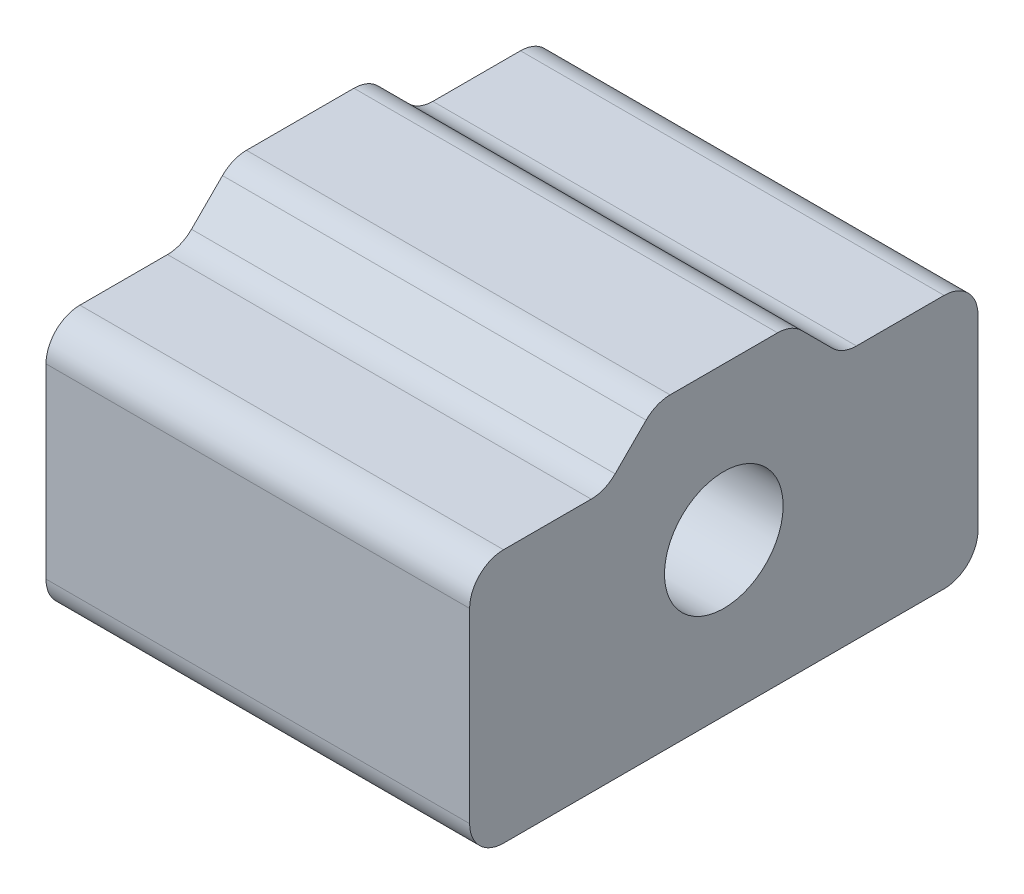
from build123d import *

# Parameters (mm, degrees)
SKETCH_1_W          = 25
SKETCH_1_H          = 30
EXTRUDE_2_DEPTH     = 18
CUT_EXTRUDE_1_DEPTH = 33
CUT_EXTRUDE_2_DEPTH = 33
SKETCH_6_R          = 3.5
CUT_EXTRUDE_3_DEPTH = 33
SKETCH_8_R          = 2
CUT_EXTRUDE_4_DEPTH = 6
FILLET_2_R          = 2


with BuildPart() as part:
    # 草图1 → 凸台-拉伸2 (new body)
    with BuildSketch(Plane(origin=(0, 0, 0), x_dir=(1, 0, 0), z_dir=(0, 1, 0))):
        with Locations((-18.558036971, -0.486406136)):
            Rectangle(SKETCH_1_W, SKETCH_1_H)
    extrude(amount=EXTRUDE_2_DEPTH)

    # 草图3 → 切除-拉伸1 (cut)
    with BuildSketch(Plane(origin=(-6.058036971, 0, 0), x_dir=(0, 0, -1), z_dir=(1, 0, 0))):
        Polygon((-15.486406136, 15), (-7.486406136, 15), (-4.486406136, 18), (-15.486406136, 18), align=None)
    extrude(amount=-CUT_EXTRUDE_1_DEPTH, mode=Mode.SUBTRACT)

    # 草图5 → 切除-拉伸2 (cut)
    with BuildSketch(Plane(origin=(-6.058036971, 0, 0), x_dir=(0, 0, -1), z_dir=(1, 0, 0))):
        Polygon((14.513593864, 18), (14.513593864, 15), (6.513593864, 15), (3.513593864, 18), align=None)
    extrude(amount=-CUT_EXTRUDE_2_DEPTH, mode=Mode.SUBTRACT)

    # 草图6 → 切除-拉伸3 (cut)
    with BuildSketch(Plane(origin=(-6.058036971, 0, 0), x_dir=(0, 0, -1), z_dir=(1, 0, 0))):
        with Locations((-0.486406136, 9)):
            Circle(SKETCH_6_R)
    extrude(amount=-CUT_EXTRUDE_3_DEPTH, mode=Mode.SUBTRACT)

    # 草图8 → 切除-拉伸4 (cut)
    with BuildSketch(Plane.XZ):
        with Locations(Location((-11.058036971, 10.486406136, 0), (0, 0, 270))):
            Circle(SKETCH_8_R)
        with Locations(Location((-11.058036971, -9.513593864, 0), (0, 0, 270))):
            Circle(SKETCH_8_R)
        with Locations(Location((-26.058036971, 10.486406136, 0), (0, 0, 270))):
            Circle(SKETCH_8_R)
        with Locations(Location((-26.058036971, -9.513593864, 0), (0, 0, 270))):
            Circle(SKETCH_8_R)
    extrude(amount=-CUT_EXTRUDE_4_DEPTH, mode=Mode.SUBTRACT)

    # 圆角2
    fillet_2_edges = [part.edges().sort_by_distance(p)[0] for p in [
        (-18.558036971, 18, 4.486406136),
        (-18.558036971, 15, 7.486406136),
        (-18.558036971, 15, 15.486406136),
        (-18.558036971, 18, -3.513593864),
        (-18.558036971, 15, -14.513593864),
        (-18.558036971, 15, -6.513593864),
        (-18.558036971, 0, -14.513593864),
        (-18.558036971, 0, 15.486406136),
    ]]
    fillet(fillet_2_edges, radius=FILLET_2_R)


solid = part.part
